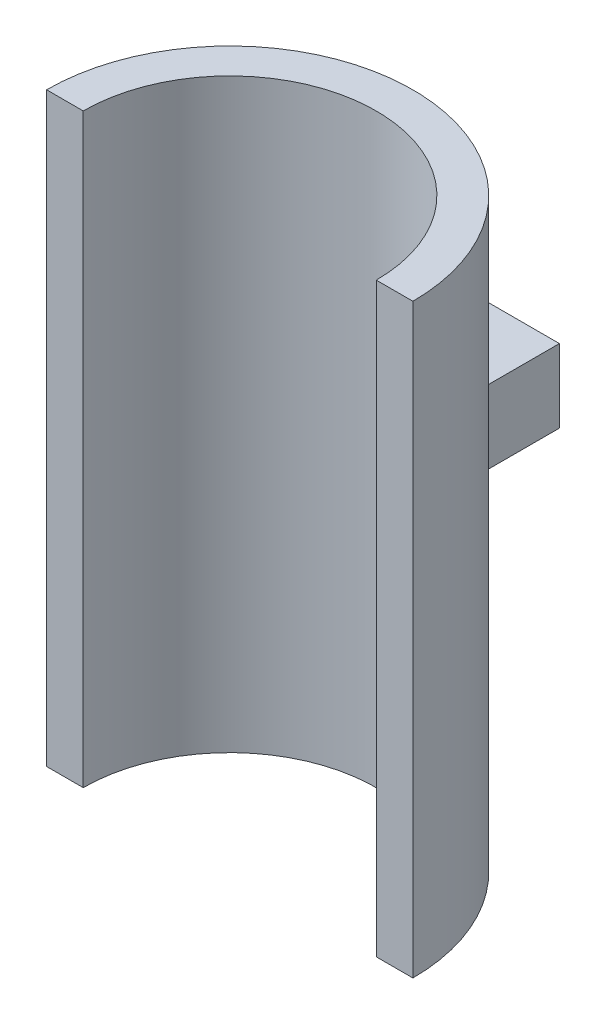
from build123d import *

# Parameters (mm, degrees)
BOSS_EXTRU_3_DEPTH      = 16
BOSS_EXTRU_4_REACH      = 27.471
BOSS_EXTRU_4_END_RADIUS = 5
ESQUISSE4_W             = 2
ESQUISSE4_H             = 2


with BuildPart() as part:
    # Esquisse3 → Boss.-Extru.3 (new body)
    with BuildSketch(Plane(origin=(0, 7.659672056, 0), x_dir=(-1, 0, 0), z_dir=(0, 1, 0))):
        with BuildLine():
            Line((-4, 0), (-5, 0))
            ThreePointArc((-5, 0), (0, -5), (5, 0))
            Line((5, 0), (4, 0))
            ThreePointArc((4, 0), (0, -4), (-4, 0))
        make_face()
    extrude(amount=BOSS_EXTRU_3_DEPTH)

    # Boss.-Extru.4: up to this cylinder (the profile starts outside it)
    boss_extru_4_end = Plane(origin=(0, 15.659672, 0), z_dir=(0, -1, 0)) * Cylinder(BOSS_EXTRU_4_END_RADIUS, 65.942, mode=Mode.PRIVATE)
    # Esquisse4 → Boss.-Extru.4 (add, up to the surface)
    with BuildSketch(Plane.XY.offset(-8), mode=Mode.PRIVATE) as boss_extru_4_sk1:
        with Locations((0, 15.659672056)):
            Rectangle(ESQUISSE4_W, ESQUISSE4_H)
    boss_extru_4_tool1 = extrude(boss_extru_4_sk1.sketch, amount=BOSS_EXTRU_4_REACH, mode=Mode.PRIVATE) - boss_extru_4_end
    add(boss_extru_4_tool1.solids().sort_by_distance((0, 15.659672, -8))[0])


solid = part.part
